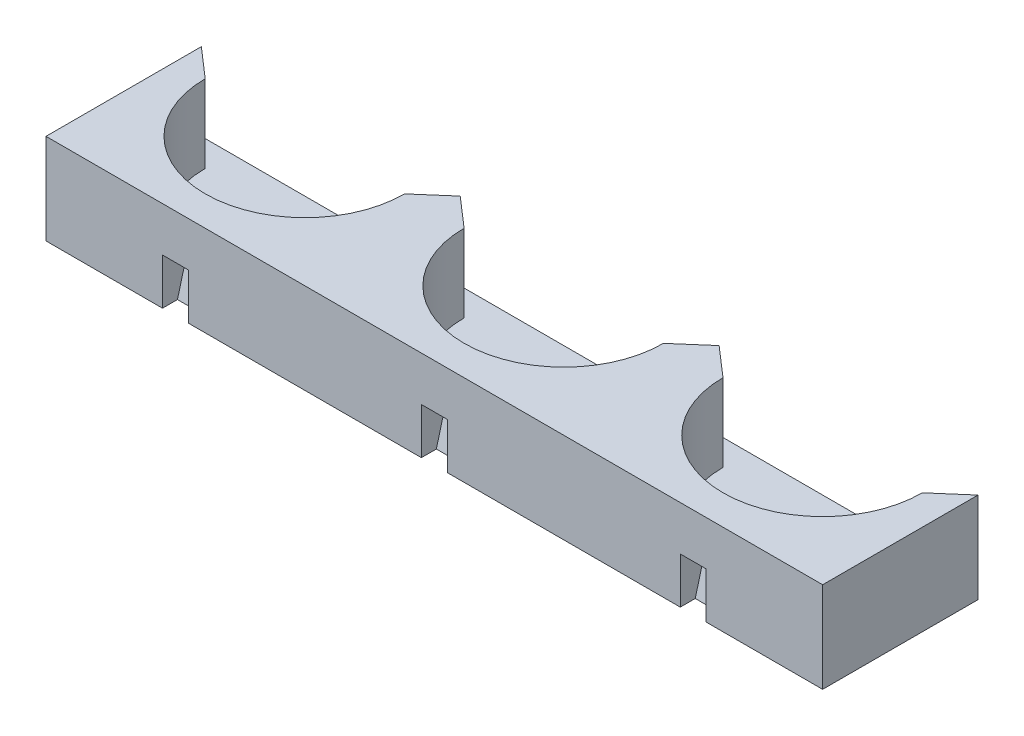
from build123d import *

# Parameters (mm, degrees)
BOSS_EXTRU_1_DEPTH         = 30
ESQUISSE2_W                = 300
ESQUISSE2_H                = 60
BOSS_EXTRU_2_DEPTH         = 5
ESQUISSE3_W                = 10
ESQUISSE3_H                = 5.78
ENL_V_MAT_EXTRU_3_DEPTH    = 14.49
ESQUISSE5_W                = 10
ESQUISSE5_H                = 17.8
ENL_V_MAT_EXTRU_5_DEPTH    = 5
BOSS_EXTRU_4_REACH         = 256.018
ENL_V_MAT_EXTRU_6_DEPTH    = 10
R_P_TITION_LIN_AIRE1_COUNT = 3
R_P_TITION_LIN_AIRE1_PITCH = 100


with BuildPart() as part:
    # Esquisse1 → Boss.-Extru.1 (new body)
    with BuildSketch(Plane(origin=(0, 0, 0), x_dir=(1, 0, 0), z_dir=(0, 1, 0))):
        with BuildLine():
            Line((0, 0), (300, 0))
            Line((300, 0), (300, 60))
            Line((300, 60), (288.5, 50))
            ThreePointArc((288.5, 50), (250, 11.5), (211.5, 50))
            Line((211.5, 50), (200, 60))
            Line((200, 60), (188.5, 50))
            ThreePointArc((188.5, 50), (150, 11.5), (111.5, 50))
            Line((111.5, 50), (100, 60))
            Line((100, 60), (88.5, 50))
            ThreePointArc((88.5, 50), (50, 11.5), (11.5, 50))
            Line((11.5, 50), (0, 60))
            Line((0, 60), (0, 0))
        make_face()
    extrude(amount=BOSS_EXTRU_1_DEPTH)

    # Esquisse2 → Boss.-Extru.2 (add)
    with BuildSketch(Plane.XZ):
        with Locations((150, -30)):
            Rectangle(ESQUISSE2_W, ESQUISSE2_H)
    extrude(amount=BOSS_EXTRU_2_DEPTH)

    # Esquisse3 → Enlèv. mat.-Extru.3 (cut, along a direction that is not the sketch's normal)
    with BuildSketch(Plane.XZ.offset(5)):
        with Locations((50, -2.89)):
            Rectangle(ESQUISSE3_W, ESQUISSE3_H)
        with Locations((250, -2.89)):
            Rectangle(ESQUISSE3_W, ESQUISSE3_H)
        with Locations((150, -2.89)):
            Rectangle(ESQUISSE3_W, ESQUISSE3_H)
    extrude(amount=-ENL_V_MAT_EXTRU_3_DEPTH, dir=(0, -0.96592582628907, 0.2588190451025146), mode=Mode.SUBTRACT)

    # Esquisse5 → Enlèv. mat.-Extru.5 (cut)
    with BuildSketch(Plane.XY):
        with Locations((250, 3.9)):
            Rectangle(ESQUISSE5_W, ESQUISSE5_H)
        with Locations((150, 3.9)):
            Rectangle(ESQUISSE5_W, ESQUISSE5_H)
        with Locations((50, 3.9)):
            Rectangle(ESQUISSE5_W, ESQUISSE5_H)
    extrude(amount=-ENL_V_MAT_EXTRU_5_DEPTH, mode=Mode.SUBTRACT)

    # Esquisse7 → Boss.-Extru.4 (add, up to next)
    with BuildSketch(Plane.ZY.offset(-55), mode=Mode.PRIVATE) as boss_extru_4_sk1:
        Polygon((-9.530287964, 8.996265223), (0, 12.8), (-9.530287964, 12.8), align=None)
    boss_extru_4_tool1 = extrude(boss_extru_4_sk1.sketch, amount=BOSS_EXTRU_4_REACH, mode=Mode.PRIVATE) - part.part
    boss_extru_4 = boss_extru_4_tool1.solids().sort_by_distance((55, 11.532088, -6.353525))[0]
    add(boss_extru_4)

    # Esquisse8 → Enlèv. mat.-Extru.6 (cut)
    with BuildSketch(Plane.ZY.offset(-55)):
        Polygon((-9.530287964, 8.996265223), (0, 12.8), (0, -5), (-5.78, -5), align=None)
    enl_v_mat_extru_6 = extrude(amount=ENL_V_MAT_EXTRU_6_DEPTH, mode=Mode.SUBTRACT)

    # Répétition linéaire1: Boss.-Extru.4, Enlèv. mat.-Extru.6 ×3
    with Locations(*[(i * R_P_TITION_LIN_AIRE1_PITCH, 0, 0) for i in range(1, R_P_TITION_LIN_AIRE1_COUNT)]):
        add(boss_extru_4)
        add(enl_v_mat_extru_6, mode=Mode.SUBTRACT)


solid = part.part
